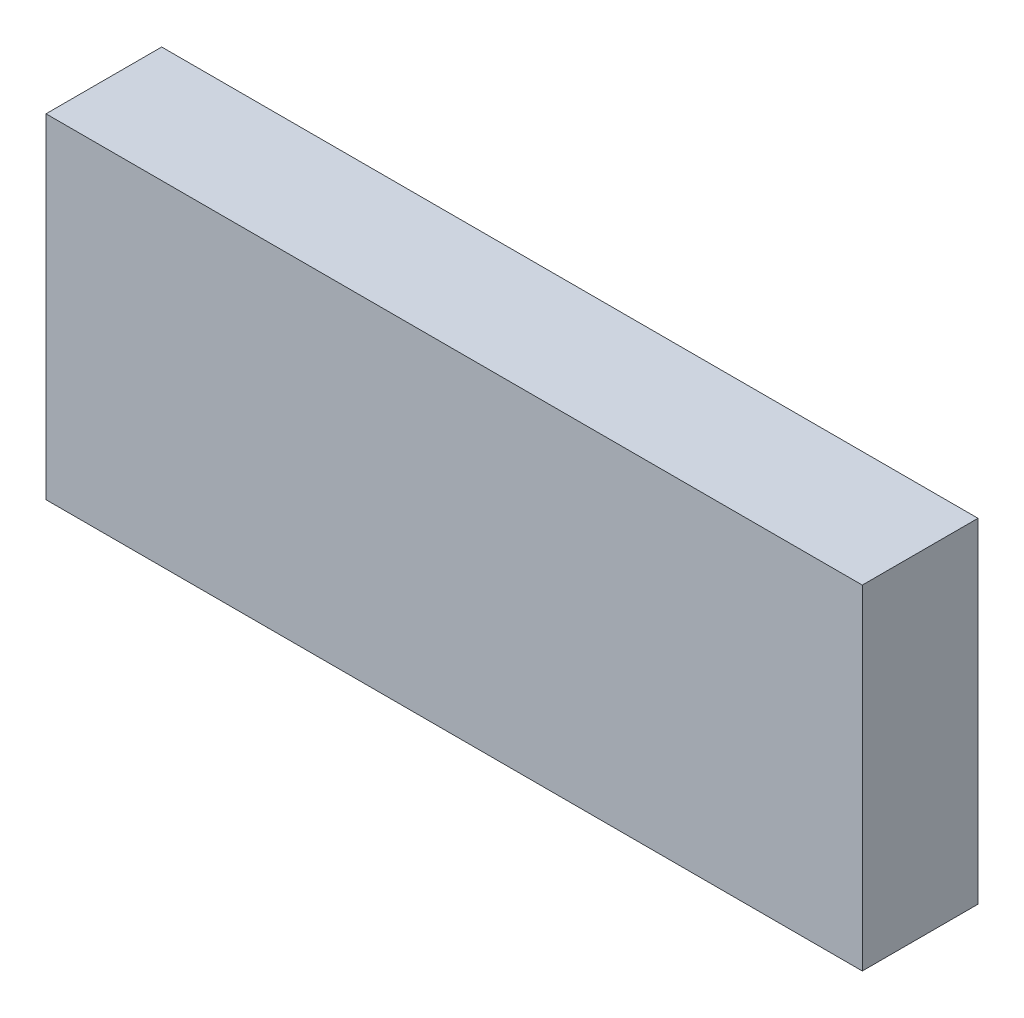
from build123d import *

# Parameters (mm, degrees)
SKETCH1_W           = 63.5
SKETCH1_H           = 26
BOSS_EXTRUDE1_DEPTH = 9


with BuildPart() as part:
    # Sketch1 → Boss-Extrude1 (new body)
    with BuildSketch(Plane.XY):
        Rectangle(SKETCH1_W, SKETCH1_H)
    extrude(amount=BOSS_EXTRUDE1_DEPTH)


solid = part.part
